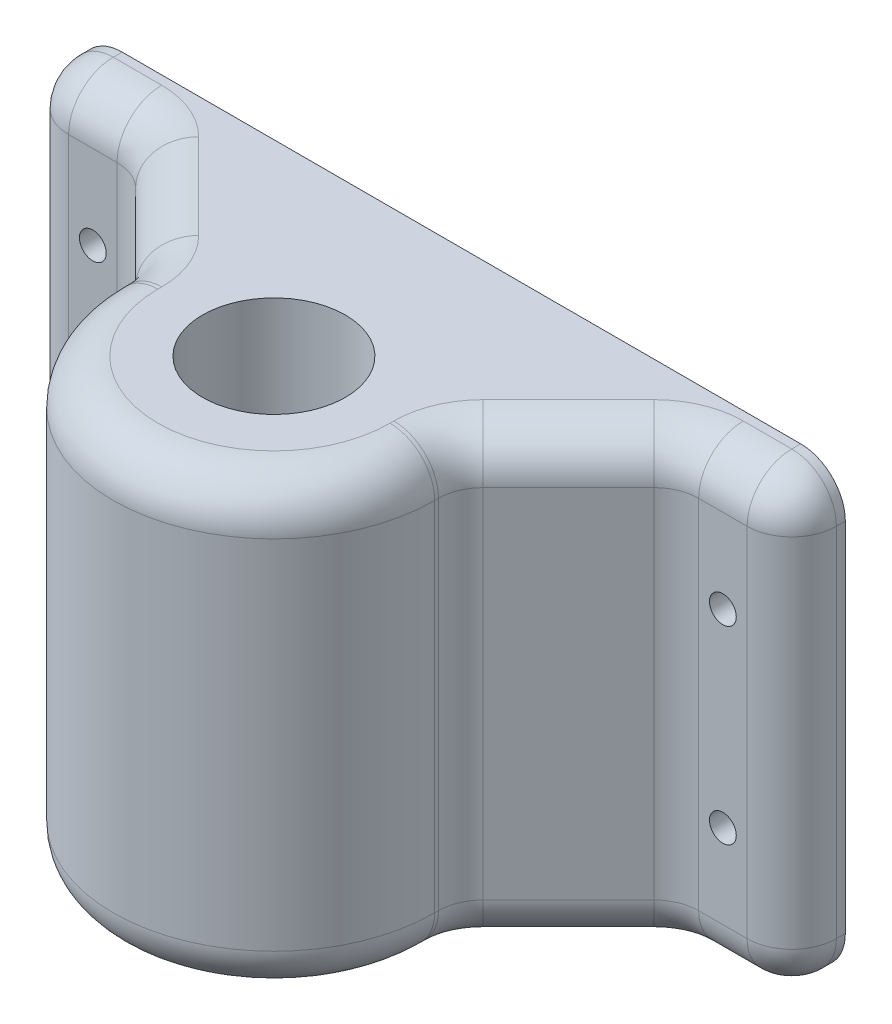
from build123d import *

# Parameters (mm, degrees)
SKETCH1_W           = 86
SKETCH1_H           = 50
BOSS_EXTRUDE2_DEPTH = 6
BOSS_EXTRUDE3_DEPTH = 50
SKETCH4_R           = 8
CUT_EXTRUDE1_DEPTH  = 121
BOSS_EXTRUDE5_DEPTH = 50
BOSS_EXTRUDE6_DEPTH = 50
FILLET1_R           = 5
FILLET2_R           = 5
FILLET3_R           = 5
FILLET4_R           = 5
FILLET5_R           = 5
SKETCH7_R           = 1.5
CUT_EXTRUDE2_DEPTH  = 50
SKETCH8_R           = 1.5
CUT_EXTRUDE4_DEPTH  = 50


with BuildPart() as part:
    # Sketch1 → Boss-Extrude2 (new body)
    with BuildSketch(Plane.XY):
        with Locations((43, 25)):
            Rectangle(SKETCH1_W, SKETCH1_H)
    extrude(amount=BOSS_EXTRUDE2_DEPTH)

    # Sketch2 → Boss-Extrude3 (add)
    with BuildSketch(Plane(origin=(0, 0, 0), x_dir=(-1, 0, 0), z_dir=(0, -1, 0))):
        with BuildLine():
            Line((-61, -21), (-61, -6))
            Line((-61, -6), (-25, -6))
            Line((-25, -6), (-25, -21))
            ThreePointArc((-25, -21), (-43, -39), (-61, -21))
        make_face()
    extrude(amount=-BOSS_EXTRUDE3_DEPTH)

    # Sketch4 → Cut-Extrude1 (cut)
    with BuildSketch(Plane(origin=(0, 0, 0), x_dir=(-1, 0, 0), z_dir=(0, -1, 0))):
        with Locations(Location((-43, -21, 0), (0, 0, 90))):
            Circle(SKETCH4_R)
    extrude(amount=-CUT_EXTRUDE1_DEPTH, mode=Mode.SUBTRACT)

    # Sketch5 → Boss-Extrude5 (add)
    with BuildSketch(Plane(origin=(0, 0, 0), x_dir=(-1, 0, 0), z_dir=(0, -1, 0))):
        Polygon((-61, -6), (-73.5, -6), (-61, -18.5), align=None)
    extrude(amount=-BOSS_EXTRUDE5_DEPTH)

    # Sketch6 → Boss-Extrude6 (add)
    with BuildSketch(Plane(origin=(0, 0, 0), x_dir=(-1, 0, 0), z_dir=(0, -1, 0))):
        Polygon((-25, -6), (-12.5, -6), (-25, -18.5), align=None)
    extrude(amount=-BOSS_EXTRUDE6_DEPTH)

    # Fillet1
    fillet1_edges = [part.edges().sort_by_distance(p)[0] for p in [
        (86, 25, 6),
    ]]
    fillet(fillet1_edges, radius=FILLET1_R)

    # Fillet2
    fillet2_edges = [part.edges().sort_by_distance(p)[0] for p in [
        (73.5, 25, 6),
    ]]
    fillet(fillet2_edges, radius=FILLET2_R)

    # Fillet3
    fillet3_edges = [part.edges().sort_by_distance(p)[0] for p in [
        (61, 25, 18.5),
    ]]
    fillet(fillet3_edges, radius=FILLET3_R)

    # Fillet4
    fillet4_edges = [part.edges().sort_by_distance(p)[0] for p in [
        (25, 25, 18.5),
        (0, 25, 6),
        (12.5, 25, 6),
    ]]
    fillet(fillet4_edges, radius=FILLET4_R)

    # Fillet5
    fillet5_edges = [part.edges().sort_by_distance(p)[0] for p in [
        (43, 0, 39),
        (61, 0, 20.785533906),
        (43, 50, 39),
        (61, 50, 20.785533906),
        (78.285533906, 50, 6),
        (86, 50, 0.5),
        (84.535533906, 50, 4.535533906),
        (86, 0, 0.5),
        (84.535533906, 0, 4.535533906),
        (78.285533906, 0, 6),
        (67.25, 0, 12.25),
        (67.25, 50, 12.25),
        (73.65765065, 0, 6.380602337),
        (73.65765065, 50, 6.380602337),
        (61.380602337, 0, 18.65765065),
        (61.380602337, 50, 18.65765065),
        (18.75, 0, 12.25),
        (18.75, 50, 12.25),
        (7.714466094, 50, 6),
        (7.714466094, 0, 6),
        (25, 50, 20.785533906),
        (25, 0, 20.785533906),
        (0, 0, 0.5),
        (1.464466094, 0, 4.535533906),
        (0, 50, 0.5),
        (1.464466094, 50, 4.535533906),
        (12.34234935, 0, 6.380602337),
        (12.34234935, 50, 6.380602337),
        (24.619397663, 0, 18.65765065),
        (24.619397663, 50, 18.65765065),
    ]]
    fillet(fillet5_edges, radius=FILLET5_R)

    # Sketch7 → Cut-Extrude2 (cut)
    with BuildSketch(Plane.XY.offset(6)):
        with Locations((7.714466094, 35.601677871)):
            Circle(SKETCH7_R)
        with Locations((7.714466094, 14.398322129)):
            Circle(SKETCH7_R)
    extrude(amount=-CUT_EXTRUDE2_DEPTH, mode=Mode.SUBTRACT)

    # Sketch8 → Cut-Extrude4 (cut)
    with BuildSketch(Plane.XY.offset(6)):
        with Locations((78.285533906, 35.60168)):
            Circle(SKETCH8_R)
        with Locations((78.285533906, 14.39832)):
            Circle(SKETCH8_R)
    extrude(amount=-CUT_EXTRUDE4_DEPTH, mode=Mode.SUBTRACT)


solid = part.part
